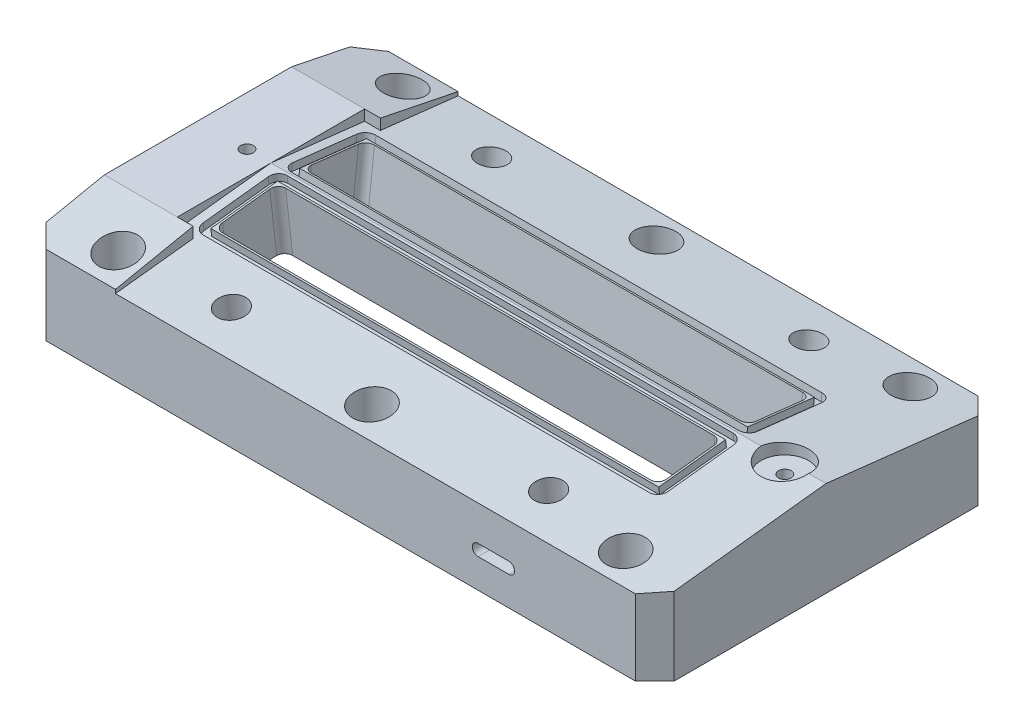
from build123d import *

# Parameters (mm, degrees)
SKETCH1_W            = 198
SKETCH1_H            = 108
BOSS_EXTRUDE1_DEPTH  = 30
SKETCH4_W            = 181
SKETCH4_H            = 45
CUT_EXTRUDE2_DEPTH   = 10
CUT_EXTRUDE3_DEPTH   = 170
BOSS_EXTRUDE11_DEPTH = 10
CUT_EXTRUDE12_DEPTH  = 170
CUT_EXTRUDE28_DEPTH  = 14.5
CUT_EXTRUDE29_DEPTH  = 14.5
CUT_EXTRUDE40_REACH  = 229.526
CUT_EXTRUDE5_DEPTH   = 28
SKETCH12_R           = 3.15
CUT_EXTRUDE9_DEPTH   = 228.52582271
SKETCH13_R           = 4.5
CUT_EXTRUDE10_DEPTH  = 16.5
SKETCH14_R           = 4.5
CUT_EXTRUDE11_DEPTH  = 16.5
SKETCH41_R           = 2.9
CUT_EXTRUDE21_DEPTH  = 7
CUT_EXTRUDE22_DEPTH  = 10
CUT_EXTRUDE23_DEPTH  = 10
SKETCH6_W            = 141.2
SKETCH6_H            = 21.2
CUT_EXTRUDE32_DEPTH  = 2.3
SKETCH23_W           = 141.2
SKETCH23_H           = 21.2
CUT_EXTRUDE33_DEPTH  = 2.3
CUT_EXTRUDE34_DEPTH  = 55.4
CUT_EXTRUDE35_DEPTH  = 55.4
CUT_EXTRUDE36_DEPTH  = 55.4
SKETCH90_R           = 6.1
CUT_EXTRUDE38_DEPTH  = 17
SKETCH96_R           = 2
CUT_EXTRUDE39_DEPTH  = 228.52582271
SKETCH98_R           = 7.5
CUT_EXTRUDE41_DEPTH  = 4
CUT_EXTRUDE42_DEPTH  = 175
CUT_EXTRUDE43_DEPTH  = 175


with BuildPart() as part:
    # Sketch1 → Boss-Extrude1 (new body)
    with BuildSketch(Plane(origin=(0, 0, 0), x_dir=(1, 0, 0), z_dir=(0, 1, 0))):
        with Locations((99, 54)):
            Rectangle(SKETCH1_W, SKETCH1_H)
    extrude(amount=BOSS_EXTRUDE1_DEPTH)

    # Sketch4 → Cut-Extrude2 (cut)
    with BuildSketch(Plane(origin=(0, 0, 0), x_dir=(1, 0, 0), z_dir=(0, 1, 0))):
        with Locations((99, 54)):
            Rectangle(SKETCH4_W, SKETCH4_H)
    extrude(amount=CUT_EXTRUDE2_DEPTH, mode=Mode.SUBTRACT)

    # Sketch5 → Cut-Extrude3 (cut)
    with BuildSketch(Plane(origin=(198, 0, 0), x_dir=(0, 0, -1), z_dir=(1, 0, 0))):
        Polygon((54, 30), (108, 23.828382143), (108, 30), align=None)
    extrude(amount=-CUT_EXTRUDE3_DEPTH, mode=Mode.SUBTRACT)

    # Sketch53 → Boss-Extrude11 (add)
    with BuildSketch(Plane(origin=(0, 10, 0), x_dir=(-1, 0, 0), z_dir=(0, -1, 0))):
        Polygon((-8.5, 51.5), (-8.5, 31.5), (-39.5, 31.5), align=None)
        Polygon((-8.5, 56.5), (-8.5, 76.5), (-39.5, 76.5), align=None)
        Polygon((-158.5, 76.5), (-189.5, 56.5), (-189.5, 76.5), align=None)
        Polygon((-158.5, 31.5), (-189.5, 51.5), (-189.5, 31.5), align=None)
    extrude(amount=BOSS_EXTRUDE11_DEPTH)

    # Sketch18 → Cut-Extrude12 (cut)
    with BuildSketch(Plane(origin=(198, 0, 0), x_dir=(0, 0, -1), z_dir=(1, 0, 0))):
        Polygon((0, 23.828382143), (0, 30), (54, 30), align=None)
    extrude(amount=-CUT_EXTRUDE12_DEPTH, mode=Mode.SUBTRACT)

    # Izq → Cut-Extrude28 (cut)
    with BuildSketch(Plane(origin=(0, 28.012686094, -12.204810084), x_dir=(1, 0, 0), z_dir=(0, 0.9167660546215654, -0.3994245874925693))):
        Polygon((8.5, 48.862182113), (29.5, 70.132603179), (8.5, 70.132603179), align=None)
    cut_extrude28 = extrude(amount=-CUT_EXTRUDE28_DEPTH, mode=Mode.SUBTRACT)

    # Der → Cut-Extrude29 (cut)
    with BuildSketch(Plane(origin=(0, -11.144923858, -4.62106599), x_dir=(1, 0, 0), z_dir=(0, 0.9237421135716327, 0.38301502270043264))):
        Polygon((8.5, 51.290217599), (29.5, 29.097876578), (8.5, 29.097876578), align=None)
    cut_extrude29 = extrude(amount=-CUT_EXTRUDE29_DEPTH, mode=Mode.SUBTRACT)

    # Cut-Extrude40: up to this face of the body (flat: up to its plane)
    cut_extrude40_end = Plane(part.part.faces().sort_by_distance((99, 10, -54))[0])
    # Sketch97 → Cut-Extrude40 (cut, up to the picked face)
    with BuildSketch(Plane(origin=(0, 0, 0), x_dir=(1, 0, 0), z_dir=(0, 1, 0)), mode=Mode.PRIVATE) as cut_extrude40_sk1:
        Polygon((8.5, 57.5), (29.5, 76.5), (158.5, 76.5), (189.5, 56.5), (189.5, 51.5), (158.5, 31.5), (29.5, 31.5), (8.5, 51.5), align=None)
    cut_extrude40_tool1 = split(extrude(cut_extrude40_sk1.sketch, amount=CUT_EXTRUDE40_REACH, mode=Mode.PRIVATE), bisect_by=cut_extrude40_end, keep=Keep.BOTH, mode=Mode.PRIVATE)
    cut_extrude40 = cut_extrude40_tool1.solids().sort_by(Axis((96.82024, 0, -54.014019), (0, 1, 0)))[0]
    add(cut_extrude40, mode=Mode.SUBTRACT)

    # Mirror2: Cut-Extrude28, Cut-Extrude29, Cut-Extrude40 across plane
    add(cut_extrude28.mirror(Plane(origin=(99, 0, 0), x_dir=(0, 0, 1), z_dir=(1, 0, 0))), mode=Mode.SUBTRACT)
    add(cut_extrude29.mirror(Plane(origin=(99, 0, 0), x_dir=(0, 0, 1), z_dir=(1, 0, 0))), mode=Mode.SUBTRACT)
    add(cut_extrude40.mirror(Plane(origin=(99, 0, 0), x_dir=(0, 0, 1), z_dir=(1, 0, 0))), mode=Mode.SUBTRACT)

    # Sketch7 → Cut-Extrude5 (cut)
    with BuildSketch(Plane(origin=(0, 0, 0), x_dir=(0, 0, -1), z_dir=(1, 0, 0))):
        Polygon((108, 30), (108, 25), (83.505102572, 30), align=None)
        Polygon((0, 25), (0, 30), (24.494897428, 30), align=None)
    extrude(amount=CUT_EXTRUDE5_DEPTH, mode=Mode.SUBTRACT)

    # Sketch12 → Cut-Extrude9 (cut, through all)
    with BuildSketch(Plane(origin=(0, 30, 0), x_dir=(1, 0, 0), z_dir=(0, 1, 0))):
        with Locations(Location((19.7, 98.85, 0), (0, 0, 270))):
            Circle(SKETCH12_R)
        with Locations(Location((99.7, 9.15, 0), (0, 0, 270))):
            Circle(SKETCH12_R)
        with Locations(Location((179.7, 9.15, 0), (0, 0, 270))):
            Circle(SKETCH12_R)
        with Locations(Location((19.7, 9.15, 0), (0, 0, 270))):
            Circle(SKETCH12_R)
        with Locations(Location((99.7, 98.85, 0), (0, 0, 270))):
            Circle(SKETCH12_R)
        with Locations(Location((179.7, 98.85, 0), (0, 0, 270))):
            Circle(SKETCH12_R)
    extrude(amount=-CUT_EXTRUDE9_DEPTH, mode=Mode.SUBTRACT)

    # Sketch13 → Cut-Extrude10 (cut)
    with BuildSketch(Plane(origin=(0, 35.705235157, -4.080723461), x_dir=(1, 0, 0), z_dir=(0, 0.9935322797694506, -0.11355002886885623))):
        with Locations(Location((51.5, 91.595772735, 0), (0, 0, 270))):
            Circle(SKETCH13_R)
        with Locations(Location((151.5, 91.595772735, 0), (0, 0, 270))):
            Circle(SKETCH13_R)
    extrude(amount=-CUT_EXTRUDE10_DEPTH, mode=Mode.SUBTRACT)

    # Sketch14 → Cut-Extrude11 (cut)
    with BuildSketch(Plane(origin=(0, 23.187709355, 5.605714967), x_dir=(1, 0, 0), z_dir=(0, 0.9935322797694507, 0.11355002886885664))):
        with Locations(Location((51.5, 18.775244426, 0), (0, 0, 270))):
            Circle(SKETCH14_R)
        with Locations(Location((151.5, 18.775244426, 0), (0, 0, 270))):
            Circle(SKETCH14_R)
    extrude(amount=-CUT_EXTRUDE11_DEPTH, mode=Mode.SUBTRACT)

    # Sketch41 → Cut-Extrude21 (cut)
    with BuildSketch(Plane(origin=(0, 0, 0), x_dir=(1, 0, 0), z_dir=(0, 1, 0))):
        with Locations(Location((139.5, 9, 0), (0, 0, 90))):
            Circle(SKETCH41_R)
        with Locations(Location((139.5, 99, 0), (0, 0, 90))):
            Circle(SKETCH41_R)
    extrude(amount=CUT_EXTRUDE21_DEPTH, mode=Mode.SUBTRACT)

    # Sketch42 → Cut-Extrude22 (cut)
    with BuildSketch(Plane.XY):
        with BuildLine():
            Line((142.3, 12.8), (152, 12.8))
            ThreePointArc((152, 12.8), (153.8, 11), (152, 9.2))
            Line((152, 9.2), (142.3, 9.2))
            ThreePointArc((142.3, 9.2), (140.5, 11), (142.3, 12.8))
        make_face()
    extrude(amount=-CUT_EXTRUDE22_DEPTH, mode=Mode.SUBTRACT)

    # Sketch43 → Cut-Extrude23 (cut)
    with BuildSketch(Plane(origin=(0, 0, -108), x_dir=(-1, 0, 0), z_dir=(0, 0, -1))):
        with BuildLine():
            Line((-55.7, 12.8), (-46, 12.8))
            ThreePointArc((-46, 12.8), (-44.2, 11), (-46, 9.2))
            Line((-46, 9.2), (-55.7, 9.2))
            ThreePointArc((-55.7, 9.2), (-57.5, 11), (-55.7, 12.8))
        make_face()
    extrude(amount=-CUT_EXTRUDE23_DEPTH, mode=Mode.SUBTRACT)

    # Sketch6 → Cut-Extrude32 (cut)
    with BuildSketch(Plane(origin=(0, 35.705235157, -4.080723461), x_dir=(1, 0, 0), z_dir=(0, 0.9935322797694506, -0.11355002886885623))):
        with BuildLine():
            Line((28.9, 77.644242241), (169.5, 77.644242241))
            ThreePointArc((169.5, 77.644242241), (171.621320344, 76.765562585), (172.5, 74.644242241))
            Line((172.5, 74.644242241), (172.5, 54.044242241))
            ThreePointArc((172.5, 54.044242241), (171.621320344, 51.922921898), (169.5, 51.044242241))
            Line((169.5, 51.044242241), (28.9, 51.044242241))
            ThreePointArc((28.9, 51.044242241), (26.778679656, 51.922921898), (25.9, 54.044242241))
            Line((25.9, 54.044242241), (25.9, 74.644242241))
            ThreePointArc((25.9, 74.644242241), (26.778679656, 76.765562585), (28.9, 77.644242241))
        make_face()
        with Locations((99.2, 64.344242241)):
            Rectangle(SKETCH6_W, SKETCH6_H, mode=Mode.SUBTRACT)
    extrude(amount=-CUT_EXTRUDE32_DEPTH, mode=Mode.SUBTRACT)

    # Sketch23 → Cut-Extrude33 (cut)
    with BuildSketch(Plane(origin=(0, 23.5211483, 2.688213682), x_dir=(1, 0, 0), z_dir=(0, 0.9935322797694506, 0.11355002886885662))):
        with BuildLine():
            Line((28.9, 56.257243974), (169.5, 56.257243974))
            ThreePointArc((169.5, 56.257243974), (171.621320344, 55.378564317), (172.5, 53.257243974))
            Line((172.5, 53.257243974), (172.5, 32.657243974))
            ThreePointArc((172.5, 32.657243974), (171.621320344, 30.53592363), (169.5, 29.657243974))
            Line((169.5, 29.657243974), (28.9, 29.657243974))
            ThreePointArc((28.9, 29.657243974), (26.778679656, 30.53592363), (25.9, 32.657243974))
            Line((25.9, 32.657243974), (25.9, 53.257243974))
            ThreePointArc((25.9, 53.257243974), (26.778679656, 55.378564317), (28.9, 56.257243974))
        make_face()
        with Locations((99.2, 42.957243974)):
            Rectangle(SKETCH23_W, SKETCH23_H, mode=Mode.SUBTRACT)
    extrude(amount=-CUT_EXTRUDE33_DEPTH, mode=Mode.SUBTRACT)

    # Sketch83 → Cut-Extrude34 (cut)
    with BuildSketch(Plane(origin=(0, 23.5211483, 2.688213682), x_dir=(1, 0, 0), z_dir=(0, 0.9935322797694506, 0.11355002886885662))):
        with BuildLine():
            Line((31.7, 52.957243974), (166.7, 52.957243974))
            ThreePointArc((166.7, 52.957243974), (168.467766953, 52.225010927), (169.2, 50.457243974))
            Line((169.2, 50.457243974), (169.2, 35.457243974))
            ThreePointArc((169.2, 35.457243974), (168.467766953, 33.689477021), (166.7, 32.957243974))
            Line((166.7, 32.957243974), (31.7, 32.957243974))
            ThreePointArc((31.7, 32.957243974), (29.932233047, 33.689477021), (29.2, 35.457243974))
            Line((29.2, 35.457243974), (29.2, 50.457243974))
            ThreePointArc((29.2, 50.457243974), (29.932233047, 52.225010927), (31.7, 52.957243974))
        make_face()
    extrude(amount=-CUT_EXTRUDE34_DEPTH, mode=Mode.SUBTRACT)

    # Sketch84 → Cut-Extrude35 (cut)
    with BuildSketch(Plane(origin=(0, 35.705235157, -4.080723461), x_dir=(1, 0, 0), z_dir=(0, 0.9935322797694506, -0.11355002886885623))):
        with BuildLine():
            Line((31.7, 54.344242241), (166.7, 54.344242241))
            ThreePointArc((166.7, 54.344242241), (168.467766953, 55.076475289), (169.2, 56.844242241))
            Line((169.2, 56.844242241), (169.2, 71.844242241))
            ThreePointArc((169.2, 71.844242241), (168.467766953, 73.612009194), (166.7, 74.344242241))
            Line((166.7, 74.344242241), (31.7, 74.344242241))
            ThreePointArc((31.7, 74.344242241), (29.932233047, 73.612009194), (29.2, 71.844242241))
            Line((29.2, 71.844242241), (29.2, 56.844242241))
            ThreePointArc((29.2, 56.844242241), (29.932233047, 55.076475289), (31.7, 54.344242241))
        make_face()
    extrude(amount=-CUT_EXTRUDE35_DEPTH, mode=Mode.SUBTRACT)

    # Sketch85 → Cut-Extrude36 (cut)
    with BuildSketch(Plane(origin=(0, 30, 0), x_dir=(1, 0, 0), z_dir=(0, 1, 0))):
        Polygon((0, 101.9), (6.1, 108), (0, 108), align=None)
        Polygon((0, 0), (6.1, 0), (0, 6.1), align=None)
        Polygon((198, 6.1), (191.9, 0), (198, 0), align=None)
        Polygon((198, 108), (191.9, 108), (198, 101.9), align=None)
    extrude(amount=-CUT_EXTRUDE36_DEPTH, mode=Mode.SUBTRACT)

    # Sketch90 → Cut-Extrude38 (cut)
    with BuildSketch(Plane(origin=(0, 30, 0), x_dir=(1, 0, 0), z_dir=(0, 1, 0))):
        with Locations(Location((19.7, 9.15, 0), (0, 0, 270))):
            Circle(SKETCH90_R)
        with Locations(Location((99.7, 9.15, 0), (0, 0, 270))):
            Circle(SKETCH90_R)
        with Locations(Location((179.7, 9.15, 0), (0, 0, 270))):
            Circle(SKETCH90_R)
        with Locations(Location((99.7, 98.85, 0), (0, 0, 270))):
            Circle(SKETCH90_R)
        with Locations(Location((179.7, 98.85, 0), (0, 0, 270))):
            Circle(SKETCH90_R)
        with Locations(Location((19.7, 98.85, 0), (0, 0, 270))):
            Circle(SKETCH90_R)
    extrude(amount=-CUT_EXTRUDE38_DEPTH, mode=Mode.SUBTRACT)

    # Sketch96 → Cut-Extrude39 (cut, through all)
    with BuildSketch(Plane(origin=(0, 0, 0), x_dir=(1, 0, 0), z_dir=(0, 1, 0))):
        with Locations(Location((15.45, 54, 0), (0, 0, 270))):
            Circle(SKETCH96_R)
        with Locations((185, 54)):
            Circle(SKETCH96_R)
    extrude(amount=CUT_EXTRUDE39_DEPTH, mode=Mode.SUBTRACT)

    # Sketch98 → Cut-Extrude41 (cut)
    with BuildSketch(Plane(origin=(0, 30, 0), x_dir=(1, 0, 0), z_dir=(0, 1, 0))):
        with Locations(Location((185, 54, 0), (0, 0, 270))):
            Circle(SKETCH98_R)
    extrude(amount=-CUT_EXTRUDE41_DEPTH, mode=Mode.SUBTRACT)

    # Sketch100 → Cut-Extrude42 (cut)
    with BuildSketch(Plane(origin=(198, 0, 0), x_dir=(0, 0, -1), z_dir=(1, 0, 0))):
        Polygon((24.494897428, 30), (24.494897428, 26.627884854), (54, 30), align=None)
    extrude(amount=-CUT_EXTRUDE42_DEPTH, mode=Mode.SUBTRACT)

    # Sketch101 → Cut-Extrude43 (cut)
    with BuildSketch(Plane(origin=(198, 0, 0), x_dir=(0, 0, -1), z_dir=(1, 0, 0))):
        Polygon((54, 30), (83.505102572, 30), (83.505102572, 26.627884854), align=None)
    extrude(amount=-CUT_EXTRUDE43_DEPTH, mode=Mode.SUBTRACT)


solid = part.part
